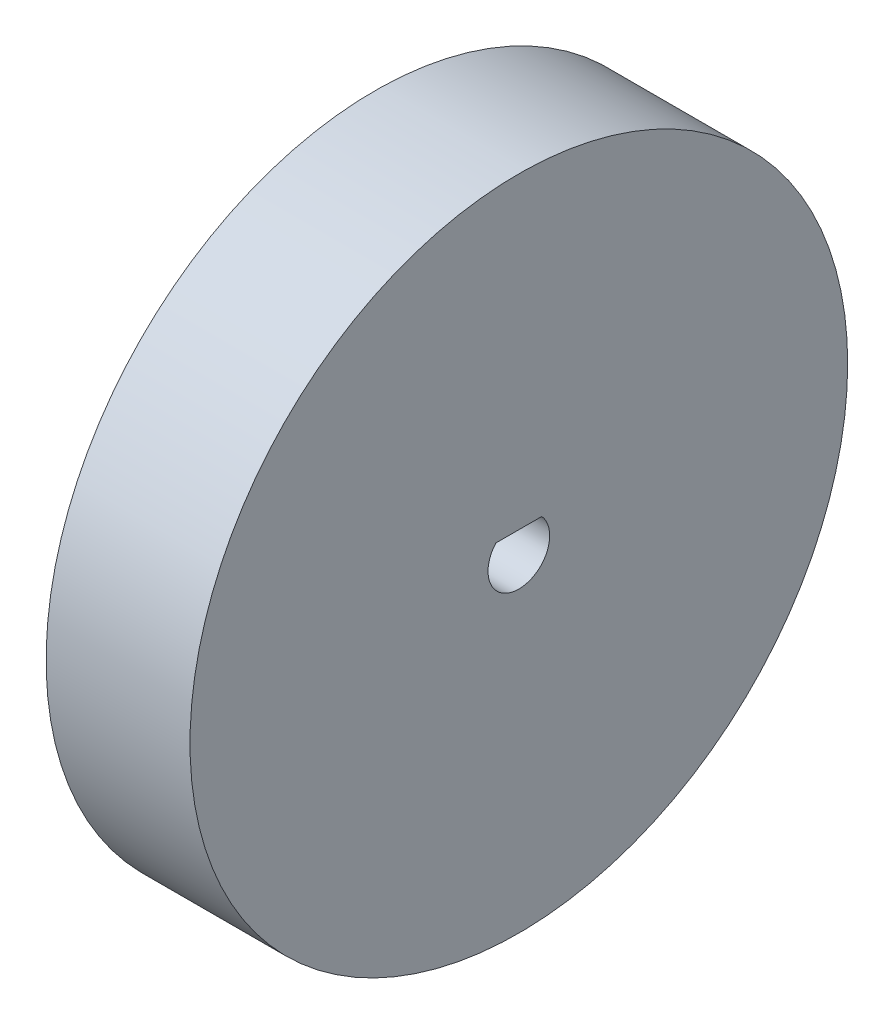
from build123d import *

# Parameters (mm, degrees)
ESQUISSE1_R        = 16
BOSS_EXTRU_1_DEPTH = 7


with BuildPart() as part:
    # Esquisse1 → Boss.-Extru.1 (new body)
    with BuildSketch(Plane(origin=(0, 0, 0), x_dir=(0, 0, -1), z_dir=(1, 0, 0))):
        Circle(ESQUISSE1_R)
        with BuildLine():
            Line((-1.118033989, 1), (1.118033989, 1))
            ThreePointArc((1.118033989, 1), (0, -1.5), (-1.118033989, 1))
        make_face(mode=Mode.SUBTRACT)
    extrude(amount=BOSS_EXTRU_1_DEPTH)


solid = part.part
